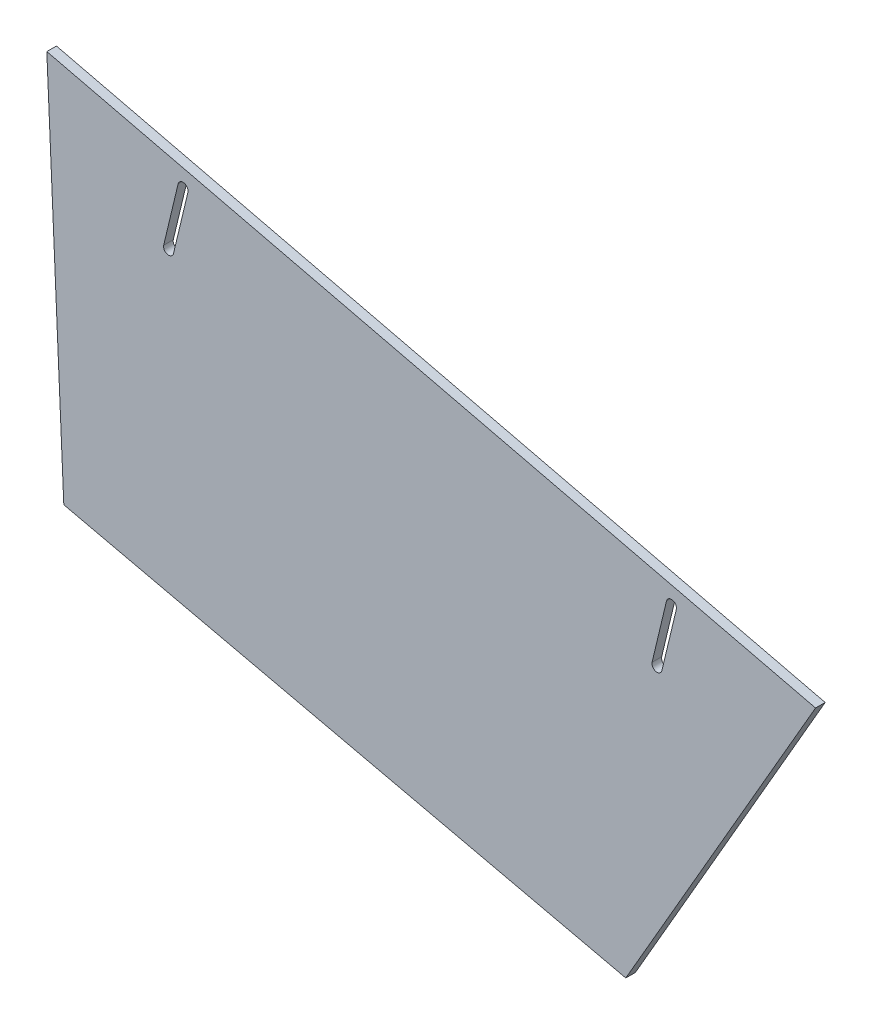
from build123d import *

# Parameters (mm, degrees)
BOSS_EXTRUDE1_DEPTH = 4


with BuildPart() as part:
    # Sketch1 → Boss-Extrude1 (new body)
    with BuildSketch(Plane(origin=(0, 0, 0), x_dir=(0, 1, 0), z_dir=(0, 0, 1))):
        Polygon((0, 0), (136.832013798, -79), (213.480030045, 241), (53.636318593, 233.929787175), align=None)
        with BuildLine():
            Line((167.998036635, 192.356313097), (193.088330721, 186.346559132))
            ThreePointArc((193.088330721, 186.346559132), (194.64139794, 183.815159872), (192.10999868, 182.262092653))
            Line((192.10999868, 182.262092653), (167.019704595, 188.271846618))
            ThreePointArc((167.019704595, 188.271846618), (165.466637376, 190.803245878), (167.998036635, 192.356313097))
        make_face(mode=Mode.SUBTRACT)
        with BuildLine():
            Line((118.32403237, -15.029111125), (143.414326455, -21.03886509))
            ThreePointArc((143.414326455, -21.03886509), (145.945725715, -19.485797871), (144.392658496, -16.954398611))
            Line((144.392658496, -16.954398611), (119.30236441, -10.944644646))
            ThreePointArc((119.30236441, -10.944644646), (116.77096515, -12.497711865), (118.32403237, -15.029111125))
        make_face(mode=Mode.SUBTRACT)
    extrude(amount=BOSS_EXTRUDE1_DEPTH)


solid = part.part
